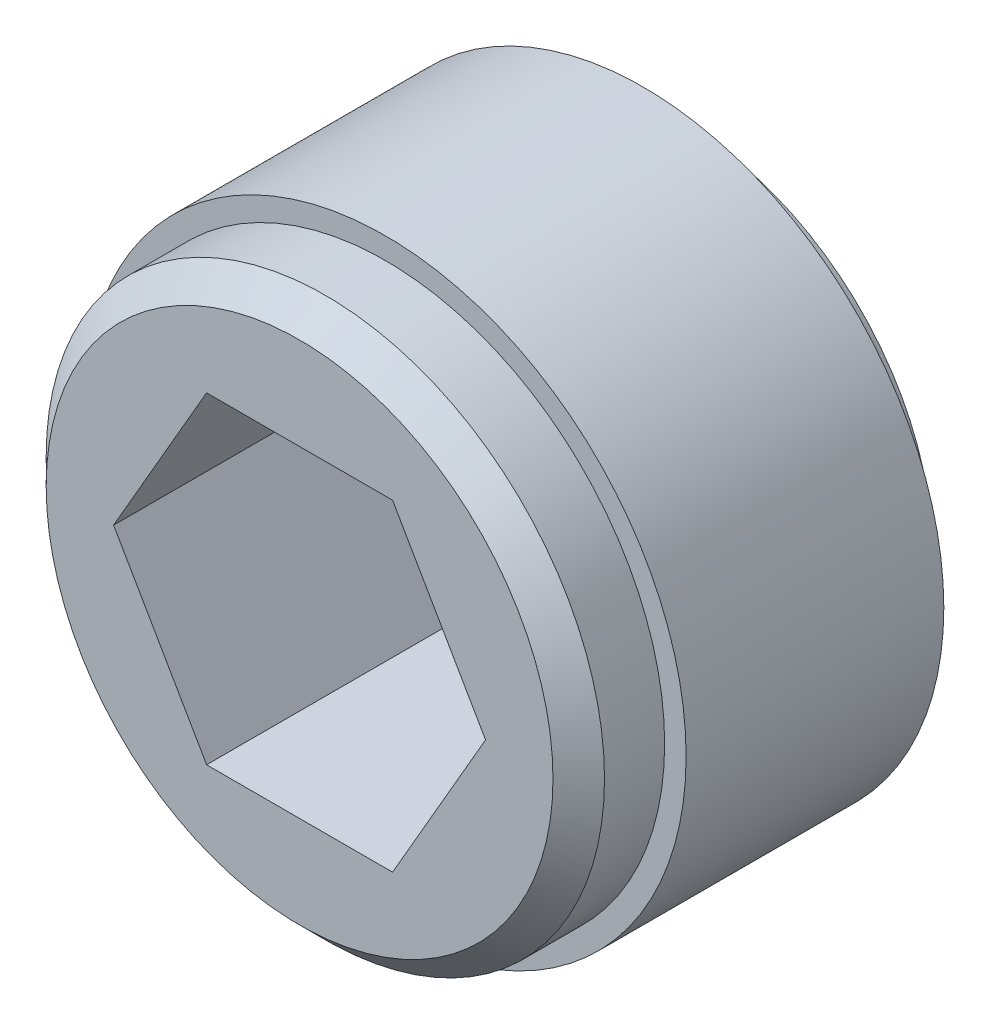
from build123d import *

# Parameters (mm, degrees)
SKETCH1_R           = 4.445
BOSS_EXTRUDE1_DEPTH = 5.08
SKETCH2_R           = 3.81
BOSS_EXTRUDE2_DEPTH = 0.635
BOSS_EXTRUDE2_TAPER = 15
CUT_EXTRUDE1_START  = -1.27
SKETCH3_R           = 4.445
SKETCH3_R_2         = 4.1275
CUT_EXTRUDE1_DEPTH  = 1.27
CHAMFER1_SIZE       = 0.381
CUT_EXTRUDE2_DEPTH  = 9.495721049


with BuildPart() as part:
    # Sketch1 → Boss-Extrude1 (new body)
    with BuildSketch(Plane.XY):
        Circle(SKETCH1_R)
    extrude(amount=BOSS_EXTRUDE1_DEPTH)

    # Sketch2 → Boss-Extrude2 (add)
    with BuildSketch(Plane(origin=(0, 0, 0), x_dir=(-1, 0, 0), z_dir=(0, 0, -1))):
        Circle(SKETCH2_R)
    extrude(amount=BOSS_EXTRUDE2_DEPTH, taper=BOSS_EXTRUDE2_TAPER)

    # Sketch3 → Cut-Extrude1 (cut)
    with BuildSketch(Plane.XY.offset(5.08).offset(CUT_EXTRUDE1_START)):
        Circle(SKETCH3_R)
        Circle(SKETCH3_R_2, mode=Mode.SUBTRACT)
    extrude(amount=CUT_EXTRUDE1_DEPTH, mode=Mode.SUBTRACT)

    # Chamfer1
    chamfer1_edges = [part.edges().sort_by_distance(p)[0] for p in [
        (-4.1275, 0, 5.08),
    ]]
    chamfer(chamfer1_edges, length=CHAMFER1_SIZE)

    # Sketch5 → Cut-Extrude2 (cut, through all)
    with BuildSketch(Plane.XY.offset(5.08)):
        Polygon((-1.374815329, 2.38125), (-2.749630657, 0), (-1.374815329, -2.38125), (1.374815329, -2.38125), (2.749630657, 0), (1.374815329, 2.38125), align=None)
    extrude(amount=-CUT_EXTRUDE2_DEPTH, mode=Mode.SUBTRACT)


solid = part.part
